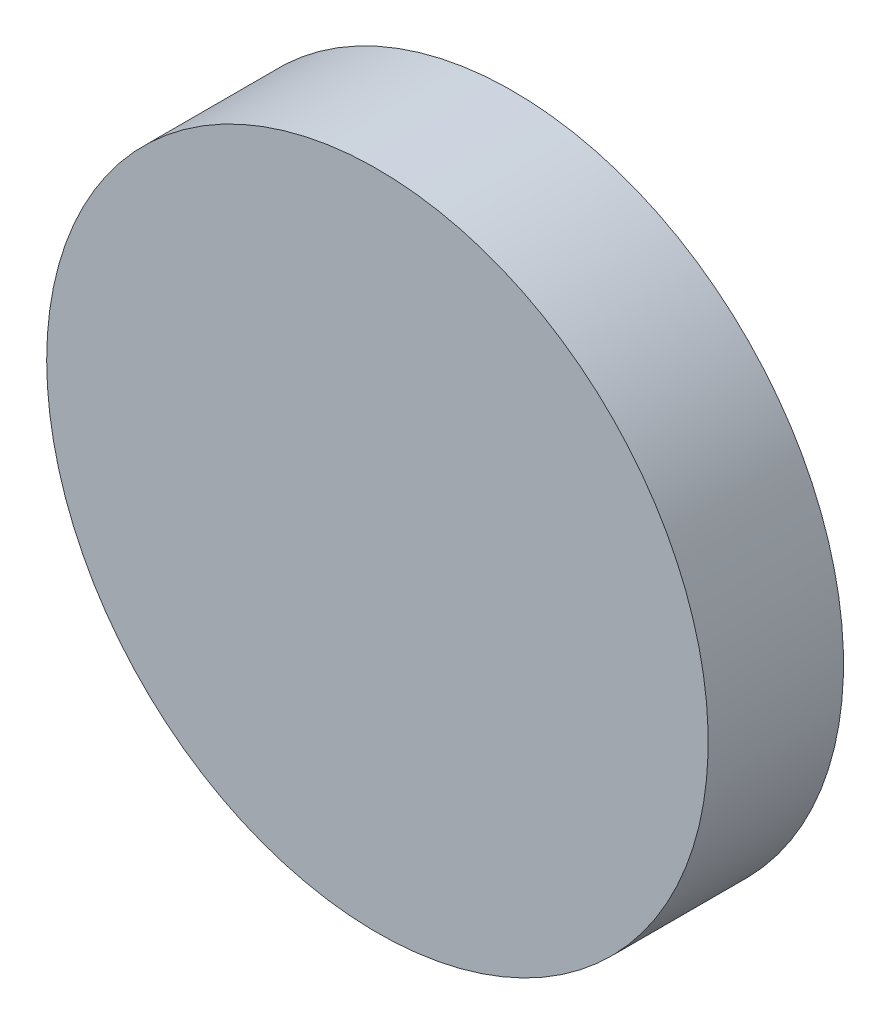
from build123d import *

# Parameters (mm, degrees)
SKETCH1_R           = 110
BOSS_EXTRUDE2_DEPTH = 45
SKETCH3_R           = 91.6
CUT_EXTRUDE1_DEPTH  = 35


with BuildPart() as part:
    # Sketch1 → Boss-Extrude2 (new body)
    with BuildSketch(Plane.XY):
        with Locations(Location((0, 0, 0), (0, 0, 180))):
            Circle(SKETCH1_R)
    extrude(amount=BOSS_EXTRUDE2_DEPTH)

    # Sketch3 → Cut-Extrude1 (cut)
    with BuildSketch(Plane.XY):
        Circle(SKETCH3_R)
    extrude(amount=CUT_EXTRUDE1_DEPTH, mode=Mode.SUBTRACT)


solid = part.part
